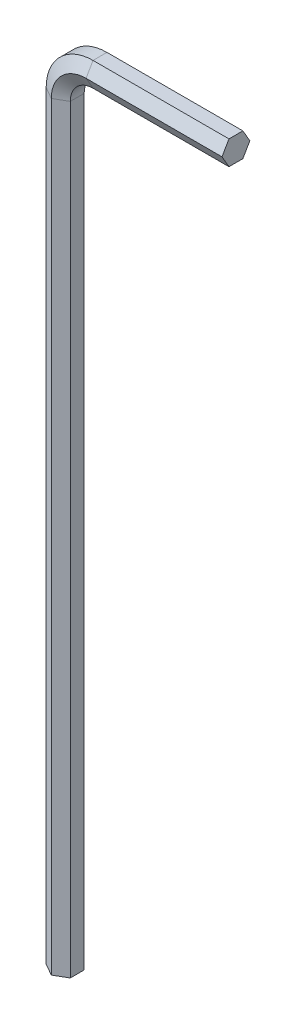
from build123d import *


with BuildPart() as part:
    # Sweep1: sweep along a path in Sketch1
    with BuildLine(Plane.XY) as sweep1_path:
        Line((0, 0), (0, 87.2157))
        ThreePointArc((0, 87.2157), (1.171572875, 90.044127125), (4, 91.2157))
        Line((4, 91.2157), (19.6157, 91.2157))
    # Sketch2 → Sweep1 (sweep)
    with BuildSketch(Plane(origin=(0, 0, 0), x_dir=(1, 0, 0), z_dir=(0, 1, 0))):
        Polygon((0, 1.598451955), (-1.3843, 0.799225978), (-1.3843, -0.799225978), (0, -1.598451955), (1.3843, -0.799225978), (1.3843, 0.799225978), align=None)
    sweep(path=sweep1_path.line)


solid = part.part
